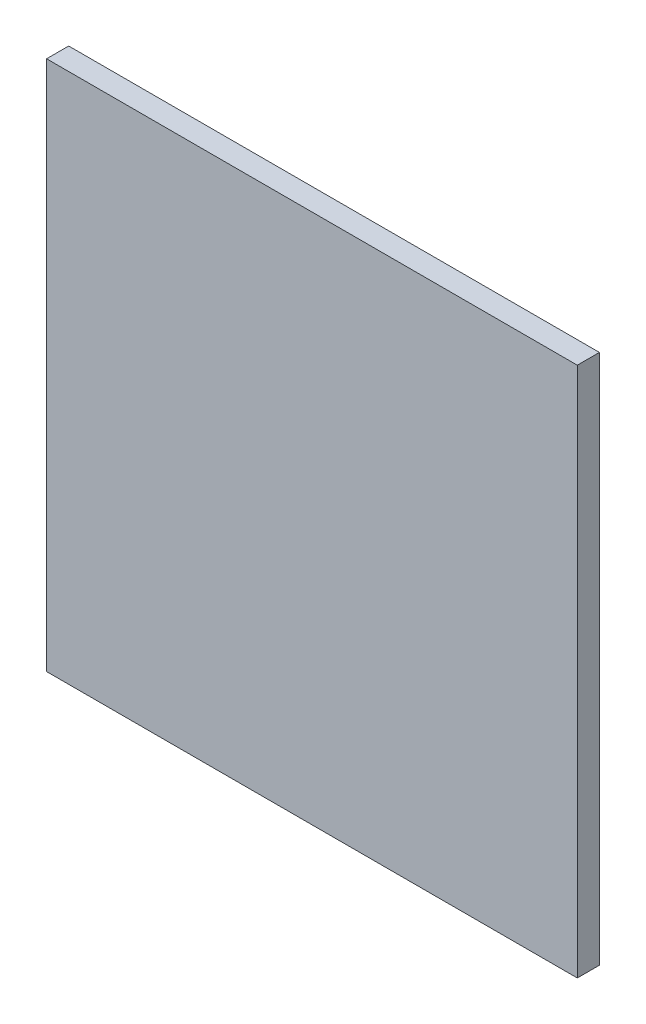
from build123d import *

# Parameters (mm, degrees)
SKETCH1_W           = 609.6
SKETCH1_H           = 609.6
BOSS_EXTRUDE1_DEPTH = 25.4


with BuildPart() as part:
    # Sketch1 → Boss-Extrude1 (new body)
    with BuildSketch(Plane.XY):
        with Locations((304.8, 304.8)):
            Rectangle(SKETCH1_W, SKETCH1_H)
    extrude(amount=BOSS_EXTRUDE1_DEPTH)


solid = part.part
